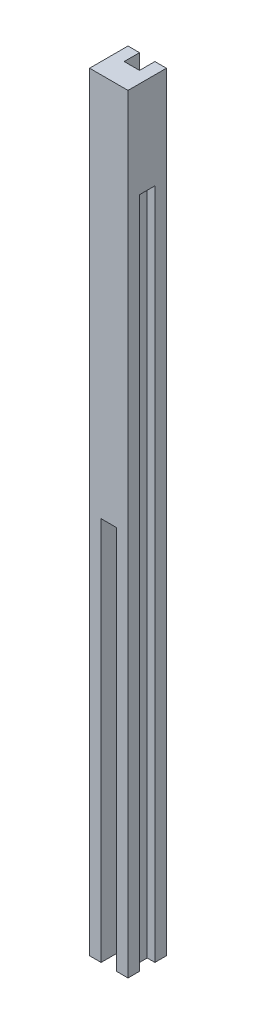
from build123d import *

# Parameters (mm, degrees)
SKETCH1_W           = 10
SKETCH1_H           = 10
BOSS_EXTRUDE1_DEPTH = 200
SKETCH3_W           = 4
SKETCH3_H           = 100
CUT_EXTRUDE3_DEPTH  = 4
SKETCH5_W           = 4
SKETCH5_H           = 175
CUT_EXTRUDE4_DEPTH  = 2
SKETCH2_W           = 4
SKETCH2_H           = 100
CUT_EXTRUDE5_DEPTH  = 4
SKETCH4_W           = 4
SKETCH4_H           = 175
CUT_EXTRUDE6_DEPTH  = 2


with BuildPart() as part:
    # Sketch1 → Boss-Extrude1 (new body)
    with BuildSketch(Plane(origin=(0, 0, 0), x_dir=(1, 0, 0), z_dir=(0, 1, 0))):
        with Locations((-38.49189023, 27.694440025)):
            Rectangle(SKETCH1_W, SKETCH1_H)
    extrude(amount=BOSS_EXTRUDE1_DEPTH)

    # Sketch3 → Cut-Extrude3 (cut)
    with BuildSketch(Plane(origin=(0, 0, -32.694440025), x_dir=(-1, 0, 0), z_dir=(0, 0, -1))):
        with Locations((38.49189023, 150)):
            Rectangle(SKETCH3_W, SKETCH3_H)
    extrude(amount=-CUT_EXTRUDE3_DEPTH, mode=Mode.SUBTRACT)

    # Sketch5 → Cut-Extrude4 (cut)
    with BuildSketch(Plane.ZY.offset(43.49189023)):
        with Locations((-27.694440025, 87.5)):
            Rectangle(SKETCH5_W, SKETCH5_H)
    extrude(amount=-CUT_EXTRUDE4_DEPTH, mode=Mode.SUBTRACT)

    # Sketch2 → Cut-Extrude5 (cut)
    with BuildSketch(Plane.XY.offset(-22.694440025)):
        with Locations((-38.49189023, 50)):
            Rectangle(SKETCH2_W, SKETCH2_H)
    extrude(amount=-CUT_EXTRUDE5_DEPTH, mode=Mode.SUBTRACT)

    # Sketch4 → Cut-Extrude6 (cut)
    with BuildSketch(Plane(origin=(-33.49189023, 0, 0), x_dir=(0, 0, -1), z_dir=(1, 0, 0))):
        with Locations((27.694440025, 87.5)):
            Rectangle(SKETCH4_W, SKETCH4_H)
    extrude(amount=-CUT_EXTRUDE6_DEPTH, mode=Mode.SUBTRACT)


solid = part.part
